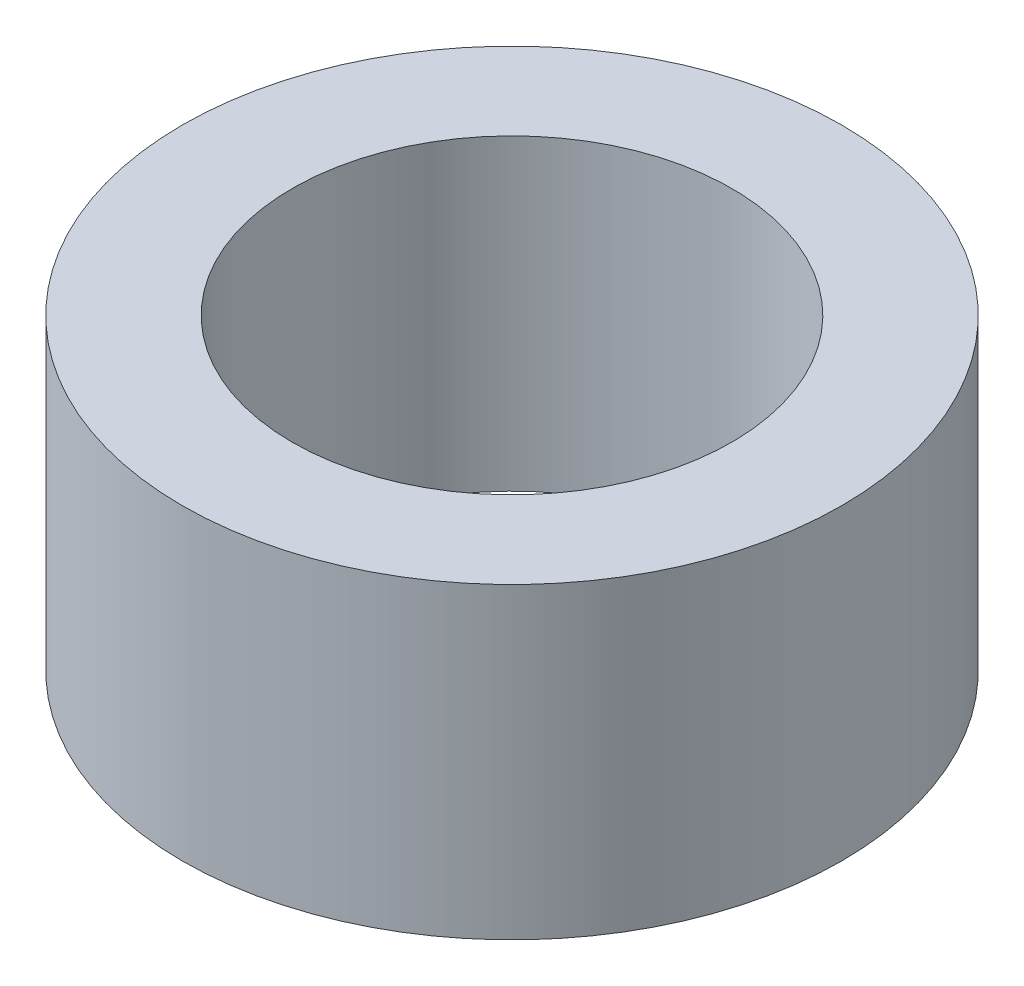
from build123d import *

# Parameters (mm, degrees)
SKETCH1_R           = 30
SKETCH1_R_2         = 20
BOSS_EXTRUDE1_DEPTH = 28


with BuildPart() as part:
    # Sketch1 → Boss-Extrude1 (new body)
    with BuildSketch(Plane(origin=(0, 0, 0), x_dir=(1, 0, 0), z_dir=(0, 1, 0))):
        with Locations(Location((0, 0, 0), (0, 0, 270))):
            Circle(SKETCH1_R)
        with Locations(Location((0, 0, 0), (0, 0, 270))):
            Circle(SKETCH1_R_2, mode=Mode.SUBTRACT)
    extrude(amount=BOSS_EXTRUDE1_DEPTH)


solid = part.part
